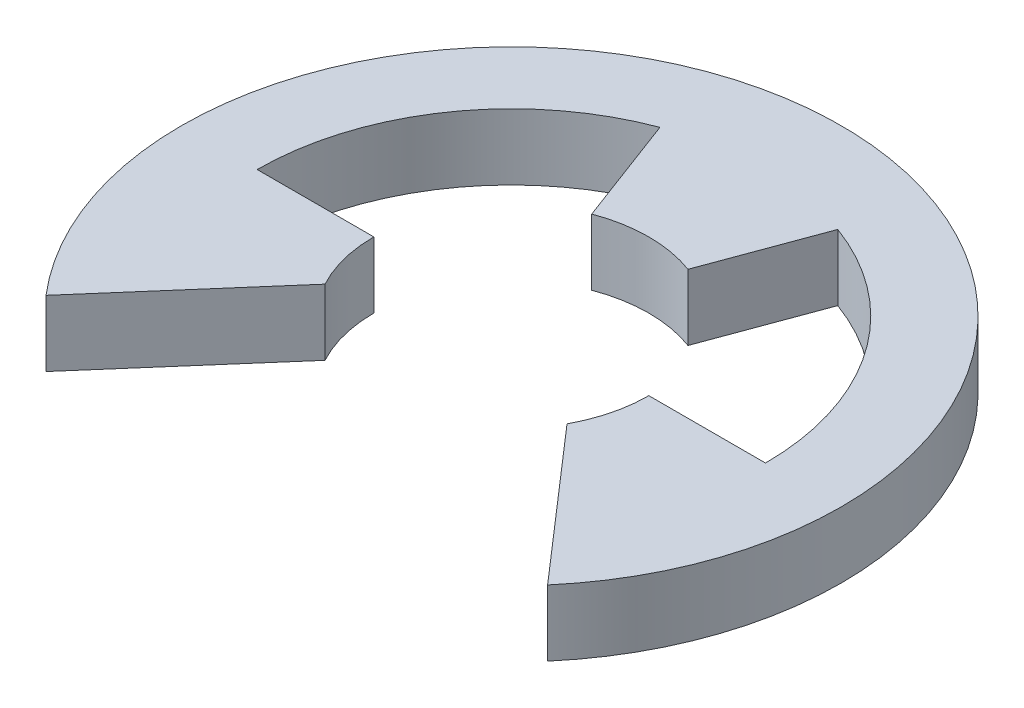
from build123d import *

# Parameters (mm, degrees)
EXTRUDE_1_DEPTH = 0.6


with BuildPart() as part:
    # 草图1 → 凸台-拉伸1 (new body)
    with BuildSketch(Plane(origin=(0, 0, 0), x_dir=(1, 0, 0), z_dir=(0, 1, 0))):
        with BuildLine():
            Line((-1.1, -0.593717104), (-2.279775485, -1.950031727))
            ThreePointArc((-2.279775485, -1.950031727), (0, 3), (2.279775485, -1.950031727))
            Line((2.279775485, -1.950031727), (1.1, -0.593717104))
            ThreePointArc((1.1, -0.593717104), (1.211919964, -0.306186218), (1.25, 0))
            Line((1.25, 0), (2.310308518, 0))
            ThreePointArc((2.310308518, 0), (1.895473318, 1.320873328), (0.799941971, 2.167398968))
            Line((0.799941971, 2.167398968), (0.432811227, 1.17267832))
            ThreePointArc((0.432811227, 1.17267832), (-0.003479103, 1.249995158), (-0.439332285, 1.170250889))
            Line((-0.439332285, 1.170250889), (-0.811994497, 2.162912477))
            ThreePointArc((-0.811994497, 2.162912477), (-1.899142339, 1.315592574), (-2.310308518, 0))
            Line((-2.310308518, 0), (-1.25, 0))
            ThreePointArc((-1.25, 0), (-1.211919964, -0.306186218), (-1.1, -0.593717104))
        make_face()
    extrude(amount=EXTRUDE_1_DEPTH)


solid = part.part
